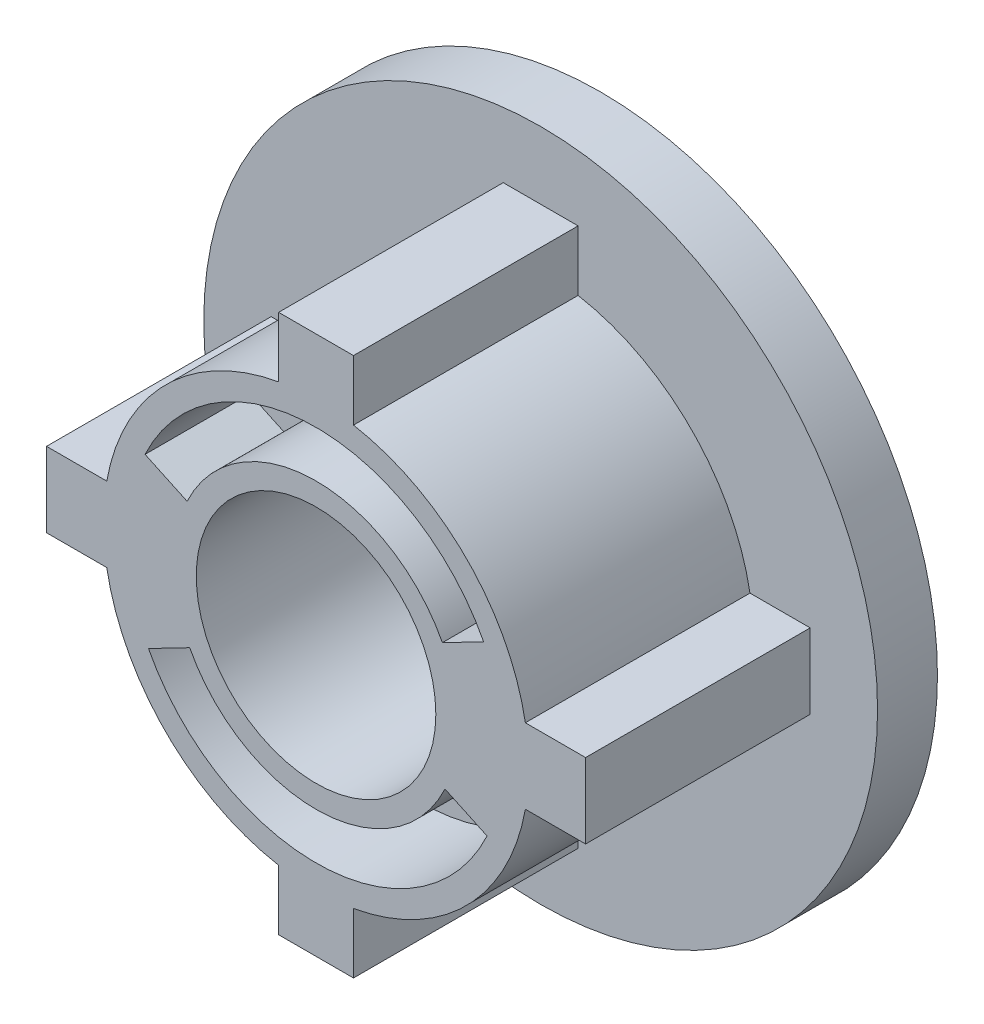
from build123d import *
from build123d.topology import SkipClean

# Parameters (mm, degrees)
ESBO_O1_R                = 11.15
RESSALTO_EXTRUS_O1_DEPTH = 15
ESBO_O2_R                = 22.5
RESSALTO_EXTRUS_O2_DEPTH = 4
RESSALTO_EXTRUS_O6_START = -8
ESBO_O5_R                = 11.15
ESBO_O5_R_2              = 8
RESSALTO_EXTRUS_O6_DEPTH = 8
RESSALTO_EXTRUS_O7_START = 4
ESBO_O7_R                = 14.2
ESBO_O7_R_2              = 11.15
RESSALTO_EXTRUS_O7_DEPTH = 4
RESSALTO_EXTRUS_O8_START = 4
ESBO_O8_R                = 11.15
ESBO_O8_R_2              = 8
RESSALTO_EXTRUS_O8_DEPTH = 4
CORTE_EXTRUS_O1_DEPTH    = 7


with BuildPart() as part:
    # Esboço1 → Ressalto-extrusão1 (new body)
    with BuildSketch(Plane.XY):
        with BuildLine():
            Line((-2.5, 18), (-2.5, 13.978197309))
            ThreePointArc((-2.5, 13.978197309), (-10.040916293, 10.040916293), (-13.978197309, 2.5))
            Line((-13.978197309, 2.5), (-18, 2.5))
            Line((-18, 2.5), (-18, -2.5))
            Line((-18, -2.5), (-13.978197309, -2.5))
            ThreePointArc((-13.978197309, -2.5), (-10.040916293, -10.040916293), (-2.5, -13.978197309))
            Line((-2.5, -13.978197309), (-2.5, -18))
            Line((-2.5, -18), (2.5, -18))
            Line((2.5, -18), (2.5, -13.978197309))
            ThreePointArc((2.5, -13.978197309), (10.040916293, -10.040916293), (13.978197309, -2.5))
            Line((13.978197309, -2.5), (18, -2.5))
            Line((18, -2.5), (18, 2.5))
            Line((18, 2.5), (13.978197309, 2.5))
            ThreePointArc((13.978197309, 2.5), (10.040916293, 10.040916293), (2.5, 13.978197309))
            Line((2.5, 13.978197309), (2.5, 18))
            Line((2.5, 18), (-2.5, 18))
        make_face()
        Circle(ESBO_O1_R, mode=Mode.SUBTRACT)
    extrude(amount=RESSALTO_EXTRUS_O1_DEPTH)

    # Esboço5 → Ressalto-extrusão6 (add)
    with BuildSketch(Plane.XY.offset(15).offset(RESSALTO_EXTRUS_O6_START)):
        Circle(ESBO_O5_R)
        Circle(ESBO_O5_R_2, mode=Mode.SUBTRACT)
    extrude(amount=RESSALTO_EXTRUS_O6_DEPTH)



with BuildPart() as body_2:
    # Esboço2 → Ressalto-extrusão2 (new body)
    # profile 1 of 5: a face of its own
    with SkipClean():  # the faces are left unmerged after this step: merging them gives an invalid solid
        with BuildSketch(Plane(origin=(0, 0, 0), x_dir=(-1, 0, 0), z_dir=(0, 0, -1))):
            Circle(ESBO_O2_R)
            with BuildLine():
                Line((2.5, 13.978197309), (2.5, 18))
                Line((2.5, 18), (-2.5, 18))
                Line((-2.5, 18), (-2.5, 13.978197309))
                ThreePointArc((-2.5, 13.978197309), (-10.040916293, 10.040916293), (-13.978197309, 2.5))
                Line((-13.978197309, 2.5), (-18, 2.5))
                Line((-18, 2.5), (-18, -2.5))
                Line((-18, -2.5), (-13.978197309, -2.5))
                ThreePointArc((-13.978197309, -2.5), (-10.040916293, -10.040916293), (-2.5, -13.978197309))
                Line((-2.5, -13.978197309), (-2.5, -18))
                Line((-2.5, -18), (2.5, -18))
                Line((2.5, -18), (2.5, -13.978197309))
                ThreePointArc((2.5, -13.978197309), (10.040916293, -10.040916293), (13.978197309, -2.5))
                Line((13.978197309, -2.5), (18, -2.5))
                Line((18, -2.5), (18, 2.5))
                Line((18, 2.5), (13.978197309, 2.5))
                ThreePointArc((13.978197309, 2.5), (10.040916293, 10.040916293), (2.5, 13.978197309))
            make_face(mode=Mode.SUBTRACT)
        # profile 2 of 5: a face of its own
        with BuildSketch(Plane(origin=(0, 0, 0), x_dir=(-1, 0, 0), z_dir=(0, 0, -1))):
            with BuildLine():
                Line((2.5, -18), (2.5, -13.978197309))
                ThreePointArc((2.5, -13.978197309), (0, -14.2), (-2.5, -13.978197309))
                Line((-2.5, -13.978197309), (-2.5, -18))
                Line((-2.5, -18), (2.5, -18))
            make_face()
        # profile 3 of 5: a face of its own
        with BuildSketch(Plane(origin=(0, 0, 0), x_dir=(-1, 0, 0), z_dir=(0, 0, -1))):
            with BuildLine():
                ThreePointArc((-13.978197309, -2.5), (-14.2, 0), (-13.978197309, 2.5))
                Line((-13.978197309, 2.5), (-18, 2.5))
                Line((-18, 2.5), (-18, -2.5))
                Line((-18, -2.5), (-13.978197309, -2.5))
            make_face()
        # profile 4 of 5: a face of its own
        with BuildSketch(Plane(origin=(0, 0, 0), x_dir=(-1, 0, 0), z_dir=(0, 0, -1))):
            with BuildLine():
                ThreePointArc((-2.5, 13.978197309), (0, 14.2), (2.5, 13.978197309))
                Line((2.5, 13.978197309), (2.5, 18))
                Line((2.5, 18), (-2.5, 18))
                Line((-2.5, 18), (-2.5, 13.978197309))
            make_face()
        # profile 5 of 5: a face of its own
        with BuildSketch(Plane(origin=(0, 0, 0), x_dir=(-1, 0, 0), z_dir=(0, 0, -1))):
            with BuildLine():
                Line((18, 2.5), (13.978197309, 2.5))
                ThreePointArc((13.978197309, 2.5), (14.2, 0), (13.978197309, -2.5))
                Line((13.978197309, -2.5), (18, -2.5))
                Line((18, -2.5), (18, 2.5))
            make_face()
        extrude(amount=RESSALTO_EXTRUS_O2_DEPTH)


with BuildPart() as part_1:
    with SkipClean():  # the faces are left unmerged after this step: merging them gives an invalid solid
        add(part.part)

        add(body_2.part)  # Ressalto-extrusão7 merges body 2
        # Esboço7 → Ressalto-extrusão7 (add)
        with BuildSketch(Plane(origin=(0, 0, 0), x_dir=(-1, 0, 0), z_dir=(0, 0, -1)).offset(RESSALTO_EXTRUS_O7_START)):
            Circle(ESBO_O7_R)
            with Locations(Location((0, 0, 0), (0, 0, 180))):
                Circle(ESBO_O7_R_2, mode=Mode.SUBTRACT)
        extrude(amount=-RESSALTO_EXTRUS_O7_DEPTH)

    # Esboço8 → Ressalto-extrusão8 (add)
    with BuildSketch(Plane(origin=(0, 0, 7), x_dir=(-1, 0, 0), z_dir=(0, 0, -1)).offset(RESSALTO_EXTRUS_O8_START)):
        Circle(ESBO_O8_R)
        with Locations(Location((0, 0, 0), (0, 0, 180))):
            Circle(ESBO_O8_R_2, mode=Mode.SUBTRACT)
    extrude(amount=-RESSALTO_EXTRUS_O8_DEPTH)

    # Esboço11 → Corte-extrusão1 (cut)
    with BuildSketch(Plane.XY.offset(15)):
        with BuildLine():
            Line((-11.191152491, -5.789482353), (-8.437773704, -4.365085901))
            ThreePointArc((-8.437773704, -4.365085901), (0.195118203, -9.497996046), (8.609923977, -4.014873487))
            Line((8.609923977, -4.014873487), (11.419478117, -5.324990098))
            ThreePointArc((11.419478117, -5.324990098), (0.258788353, -12.597342124), (-11.191152491, -5.789482353))
        make_face()
        with BuildLine():
            Line((-11.419478117, 5.324990098), (-8.609923977, 4.014873487))
            ThreePointArc((-8.609923977, 4.014873487), (-0.195118203, 9.497996046), (8.437773704, 4.365085901))
            Line((8.437773704, 4.365085901), (11.191152491, 5.789482353))
            ThreePointArc((11.191152491, 5.789482353), (-0.258788353, 12.597342124), (-11.419478117, 5.324990098))
        make_face()
    extrude(amount=-CORTE_EXTRUS_O1_DEPTH, mode=Mode.SUBTRACT)


solid = part_1.part
